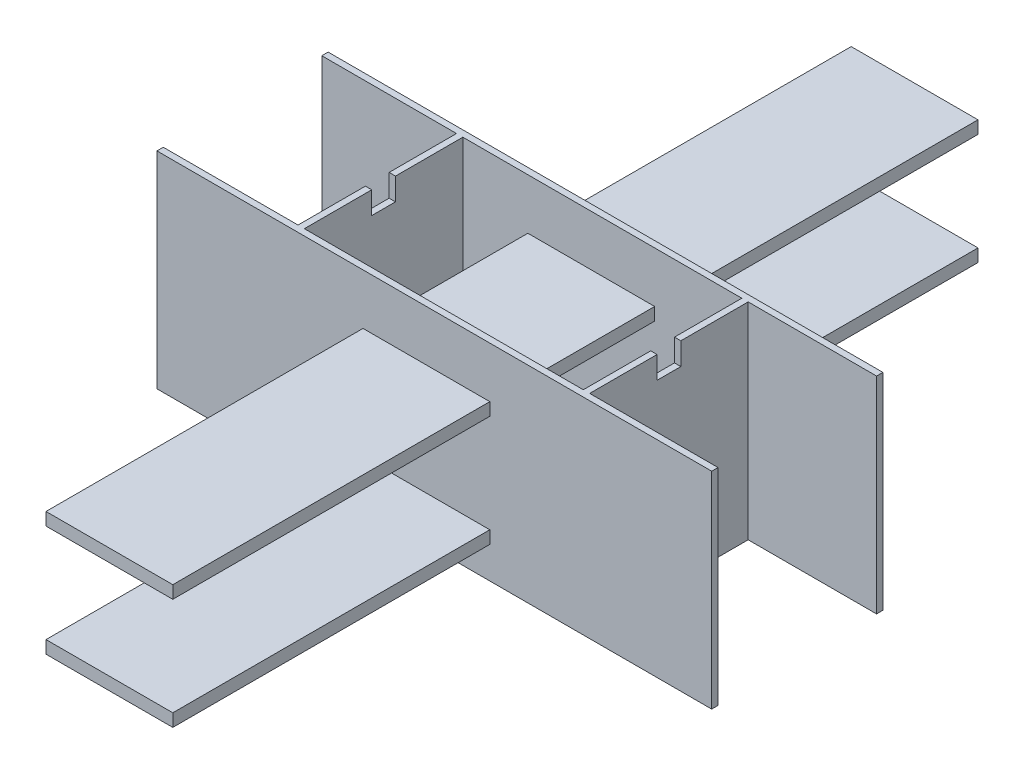
from build123d import *

# Parameters (mm, degrees)
SKETCH1_W                = 175
SKETCH1_H                = 65
BOSS_EXTRUDE1_DEPTH      = 2
SKETCH2_W                = 175
SKETCH2_H                = 65
BOSS_EXTRUDE2_DEPTH      = 2
BOSS_EXTRUDE3_DEPTH      = 127
BOSS_EXTRUDE3_DEPTH_BACK = 127
SKETCH3_W                = 40
SKETCH3_H                = 4
BOSS_EXTRUDE4_DEPTH      = 2
BOSS_EXTRUDE5_DEPTH      = 2


with BuildPart() as part:
    # Sketch1 → Boss-Extrude1 (new body)
    with BuildSketch(Plane.XY.offset(25.0000008)):
        Rectangle(SKETCH1_W, SKETCH1_H)
    extrude(amount=BOSS_EXTRUDE1_DEPTH)



with BuildPart() as body_2:
    # Sketch2 → Boss-Extrude2 (new body)
    with BuildSketch(Plane.XY.offset(-25)):
        Rectangle(SKETCH2_W, SKETCH2_H)
    extrude(amount=-BOSS_EXTRUDE2_DEPTH)


with BuildPart() as part_1:
    add(part.part)

    add(body_2.part)  # Boss-Extrude3 merges body 2
    # Sketch3 → Boss-Extrude3 (add, two sides: drawn at the far end of the back side and taken through both)
    with BuildSketch(Plane.XY.offset(-BOSS_EXTRUDE3_DEPTH_BACK)):
        with Locations((-2.5, 14.5)):
            Rectangle(SKETCH3_W, SKETCH3_H)
        with Locations((-2.5, -20.5)):
            Rectangle(SKETCH3_W, SKETCH3_H)
    extrude(amount=BOSS_EXTRUDE3_DEPTH + BOSS_EXTRUDE3_DEPTH_BACK)

    # Sketch4 → Boss-Extrude4 (add)
    with BuildSketch(Plane(origin=(45.00000144, 0, 0), x_dir=(0, 0, -1), z_dir=(1, 0, 0))):
        Polygon((3.748957701, 32.5), (25, 32.5), (25, -32.5), (-25.0000008, -32.5), (-25.0000008, 32.5), (-3.748958501, 32.5), (-3.748958501, 25.45800753), (3.748957701, 25.45800753), align=None)
    extrude(amount=BOSS_EXTRUDE4_DEPTH)

    # Sketch5 → Boss-Extrude5 (add)
    with BuildSketch(Plane(origin=(-45.00000144, 0, 0), x_dir=(0, 0, -1), z_dir=(1, 0, 0))):
        Polygon((-25.0000008, 32.5), (-25.0000008, -32.5), (25, -32.5), (25, 32.5), (3.748957701, 32.5), (3.748957701, 25.45800753), (-3.748958501, 25.45800753), (-3.748958501, 32.5), align=None)
    extrude(amount=BOSS_EXTRUDE5_DEPTH)


solid = part_1.part
